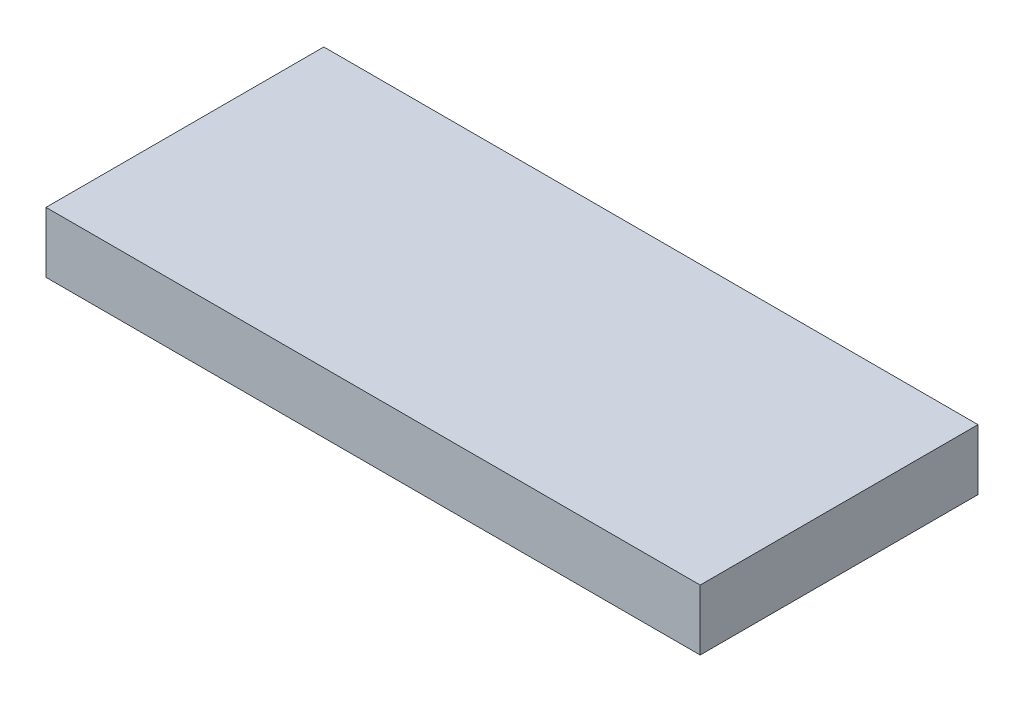
from build123d import *

# Parameters (mm, degrees)
SKETCH1_W           = 89.55
SKETCH1_H           = 38.033
BOSS_EXTRUDE1_DEPTH = 8.3


with BuildPart() as part:
    # Sketch1 → Boss-Extrude1 (new body)
    with BuildSketch(Plane(origin=(0, 0, 0), x_dir=(1, 0, 0), z_dir=(0, 1, 0))):
        with Locations((44.775, 19.0165)):
            Rectangle(SKETCH1_W, SKETCH1_H)
    extrude(amount=BOSS_EXTRUDE1_DEPTH)


solid = part.part
